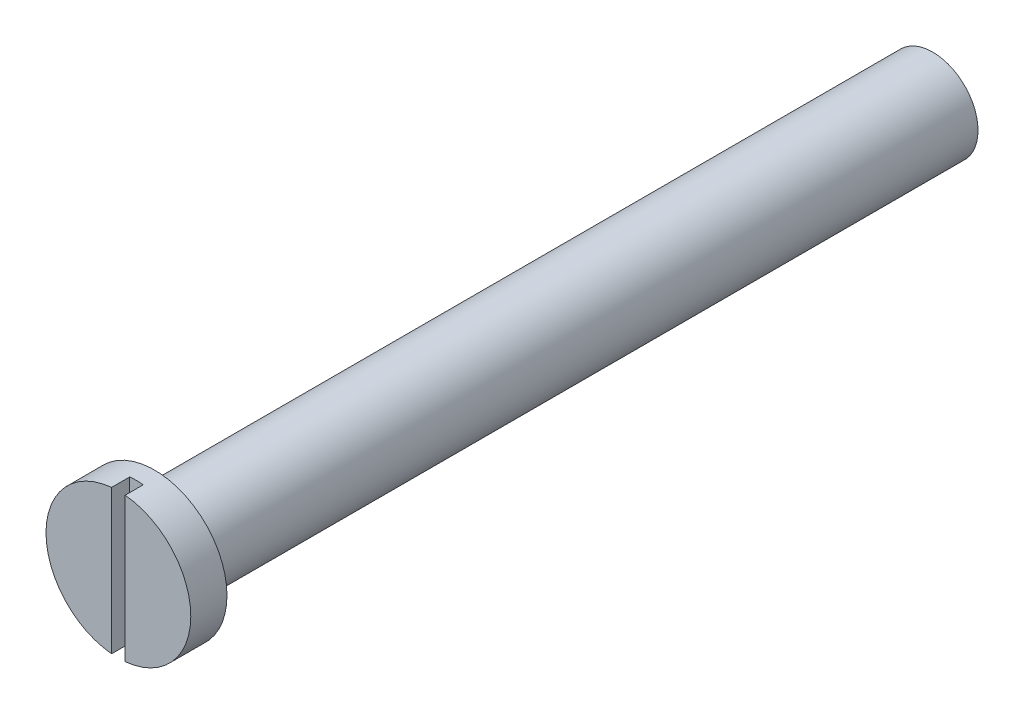
from build123d import *

# Parameters (mm, degrees)
SKETCH_1_R             = 5
EXTRUDE_1_DEPTH        = 86
SKETCH_2_R             = 8
EXTRUDE_2_DEPTH        = 4
SKETCH_4_W             = 1.5
SKETCH_4_H             = 19.56005024
CUT_EXTRUDE_1_DEPTH    = 2
HOLE_WIZARD_M8_1_D     = 6.8
HOLE_WIZARD_M8_1_DEPTH = 15
HOLE_WIZARD_M8_1_TIP   = 2.042926105


with BuildPart() as part:
    # 草图1 → 凸台-拉伸1 (new body)
    with BuildSketch(Plane.XY):
        Circle(SKETCH_1_R)
    extrude(amount=EXTRUDE_1_DEPTH)

    # 草图2 → 凸台-拉伸2 (add)
    with BuildSketch(Plane.XY.offset(86)):
        Circle(SKETCH_2_R)
    extrude(amount=EXTRUDE_2_DEPTH)

    # 草图4 → 切除-拉伸1 (cut)
    with BuildSketch(Plane.XY.offset(90)):
        Rectangle(SKETCH_4_W, SKETCH_4_H)
    extrude(amount=-CUT_EXTRUDE_1_DEPTH, mode=Mode.SUBTRACT)

    # M8 螺纹孔的螺纹孔钻头1
    with Locations(Plane(origin=(0, 0, 0), x_dir=(-1, 0, 0), z_dir=(0, 0, -1))):
        with Locations((0, 0)):
            Hole(HOLE_WIZARD_M8_1_D / 2, depth=HOLE_WIZARD_M8_1_DEPTH)
            with Locations((0, 0, -(HOLE_WIZARD_M8_1_DEPTH + HOLE_WIZARD_M8_1_TIP / 2))):  # 118° drill point
                Cone(0, HOLE_WIZARD_M8_1_D / 2, HOLE_WIZARD_M8_1_TIP, mode=Mode.SUBTRACT)


solid = part.part
